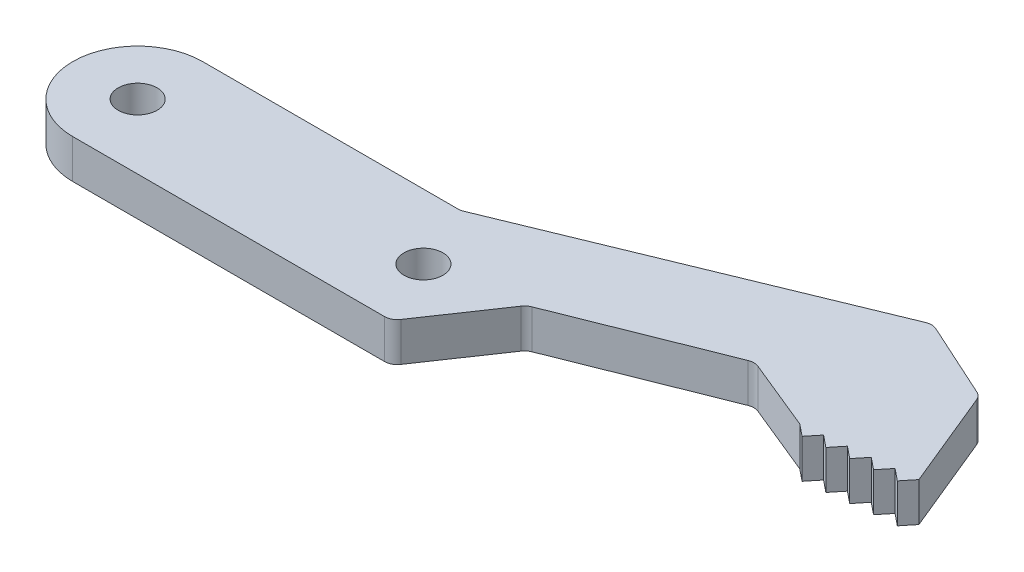
from build123d import *

# Parameters (mm, degrees)
SKETCH1_R           = 1.5
BOSS_EXTRUDE1_DEPTH = 3


with BuildPart() as part:
    # Sketch1 → Boss-Extrude1 (new body)
    with BuildSketch(Plane(origin=(0, 0, 0), x_dir=(1, 0, 0), z_dir=(0, 1, 0))):
        with BuildLine():
            Line((0, -5), (23.998875872, -5))
            ThreePointArc((23.998875872, -5), (24.467345461, -4.883479623), (24.826642543, -4.561072489))
            Line((24.826642543, -4.561072489), (28.564941326, 0.954149161))
            ThreePointArc((28.564941326, 0.954149161), (28.766036178, 1.172359953), (29.022312673, 1.321950886))
            Line((29.022312673, 1.321950886), (40.929553216, 6.070049343))
            ThreePointArc((40.929553216, 6.070049343), (41.304486381, 6.141164834), (41.678758689, 6.066649533))
            Line((41.678758689, 6.066649533), (47.144586244, 3.829406729))
            Line((47.144586244, 3.829406729), (48.06174016, 3.086958957))
            Line((48.06174016, 3.086958957), (48.804187932, 4.004112872))
            Line((48.804187932, 4.004112872), (49.721341848, 3.2616651))
            Line((49.721341848, 3.2616651), (50.46378962, 4.178819016))
            Line((50.46378962, 4.178819016), (51.380943536, 3.436371244))
            Line((51.380943536, 3.436371244), (52.123391308, 4.35352516))
            Line((52.123391308, 4.35352516), (53.040545224, 3.611077387))
            Line((53.040545224, 3.611077387), (53.782992996, 4.528231303))
            Line((53.782992996, 4.528231303), (54.700146912, 3.785783531))
            Line((54.700146912, 3.785783531), (55.442594685, 4.702937447))
            Line((55.442594685, 4.702937447), (52.341745918, 12.244834503))
            ThreePointArc((52.341745918, 12.244834503), (52.137055639, 12.558350103), (51.831402108, 12.774604725))
            Line((51.831402108, 12.774604725), (46.024183924, 15.419882568))
            ThreePointArc((46.024183924, 15.419882568), (45.628323444, 15.509674561), (45.229386093, 15.434727162))
            Line((45.229386093, 15.434727162), (20.032711481, 5.075121772))
            ThreePointArc((20.032711481, 5.075121772), (19.846254378, 5.018960187), (19.652448068, 5))
            Line((19.652448068, 5), (0, 5))
            ThreePointArc((0, 5), (-5, 0), (0, -5))
        make_face()
        with Locations(Location((0, 0, 0), (0, 0, 270))):
            Circle(SKETCH1_R, mode=Mode.SUBTRACT)
        with Locations(Location((22, 0, 0), (0, 0, 270))):
            Circle(SKETCH1_R, mode=Mode.SUBTRACT)
    extrude(amount=BOSS_EXTRUDE1_DEPTH)


solid = part.part
